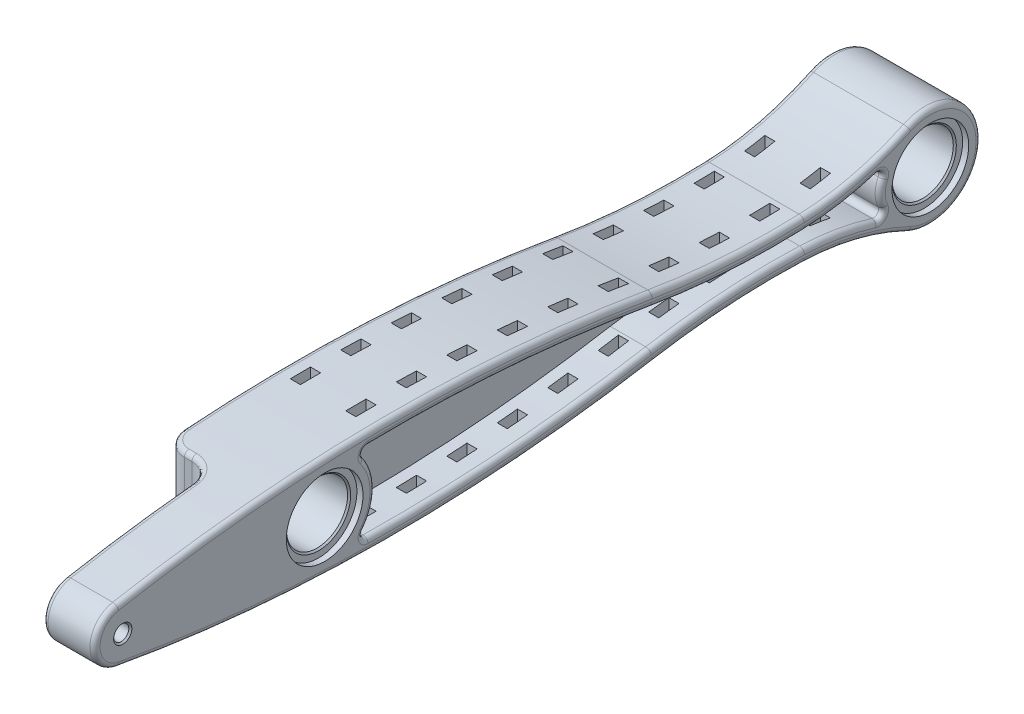
from build123d import *

# Parameters (mm, degrees)
SKETCH_1_R               = 1.5
SKETCH_1_R_2             = 6.05
EXTRUDE_1_DEPTH          = 19.8
CUT_EXTRUDE_2_DEPTH      = 132.956596089
CUT_EXTRUDE_2_DEPTH_BACK = 132.956596089
SKETCH_3_W               = 9.5
SKETCH_3_H               = 40
SKETCH_3_W_2             = 2
SKETCH_3_H_2             = 4
CUT_EXTRUDE_3_DEPTH      = 8
CUT_EXTRUDE_START        = -8
CUT_EXTRUDE_4_DEPTH      = 8
SKETCH_8_R               = 7.6
SKETCH_8_R_2             = 6.05
CUT_EXTRUDE_7_DEPTH      = 1.2
CUT_EXTRUDE_START_2      = -1.2
SKETCH_9_R               = 7.6
SKETCH_9_R_2             = 6.05
CUT_EXTRUDE_8_DEPTH      = 1.2
FILLET_4_R               = 1
FILLET_6_R               = 4
CHAMFER_1_SIZE           = 0.3
FILLET_9_R               = 1


with BuildPart() as part:
    # 草图1 → 凸台-拉伸1 (new body)
    with BuildSketch(Plane(origin=(0, 0, 0), x_dir=(0, 0, -1), z_dir=(1, 0, 0))):
        with BuildLine():
            ThreePointArc((65, 6), (11.97925586, 10.363554257), (-40.989645449, 5.410231223))
            ThreePointArc((-40.989645449, 5.410231223), (-45.5, 0), (-40.989645449, -5.410231223))
            ThreePointArc((-40.989645449, -5.410231223), (11.97925586, -10.363554257), (65, -6))
            ThreePointArc((65, -6), (79.948342089, -4.225131331), (95, -4))
            ThreePointArc((95, -4), (105.598644411, -5.47871116), (115.678175857, -9.073275928))
            ThreePointArc((115.678175857, -9.073275928), (130.05, 0), (115.678175857, 9.073275928))
            ThreePointArc((115.678175857, 9.073275928), (105.598644411, 5.47871116), (95, 4))
            ThreePointArc((95, 4), (79.948342089, 4.225131331), (65, 6))
        make_face()
        with Locations(Location((-40, 0, 0), (0, 0, 180))):
            Circle(SKETCH_1_R, mode=Mode.SUBTRACT)
        with Locations(Location((0, 0, 0), (0, 0, 180))):
            Circle(SKETCH_1_R_2, mode=Mode.SUBTRACT)
        with Locations(Location((120, 0, 0), (0, 0, 180))):
            Circle(SKETCH_1_R_2, mode=Mode.SUBTRACT)
    extrude(amount=EXTRUDE_1_DEPTH)

    # 草图3 → 切除-拉伸2 (cut, two sides: drawn at the far end of the back side and taken through both)
    with BuildSketch(Plane(origin=(0, 0, 0), x_dir=(1, 0, 0), z_dir=(0, 1, 0)).offset(-CUT_EXTRUDE_2_DEPTH_BACK)):
        with Locations((4.75, -32)):
            Rectangle(SKETCH_3_W, SKETCH_3_H)
        with Locations((4, 12)):
            Rectangle(SKETCH_3_W_2, SKETCH_3_H_2)
        with Locations((15, 12)):
            Rectangle(SKETCH_3_W_2, SKETCH_3_H_2)
        with Locations((15, 22)):
            Rectangle(SKETCH_3_W_2, SKETCH_3_H_2)
        with Locations((4, 22)):
            Rectangle(SKETCH_3_W_2, SKETCH_3_H_2)
        with Locations((4, 32)):
            Rectangle(SKETCH_3_W_2, SKETCH_3_H_2)
        with Locations((15, 32)):
            Rectangle(SKETCH_3_W_2, SKETCH_3_H_2)
        with Locations((15, 42)):
            Rectangle(SKETCH_3_W_2, SKETCH_3_H_2)
        with Locations((4, 42)):
            Rectangle(SKETCH_3_W_2, SKETCH_3_H_2)
        with Locations((4, 52)):
            Rectangle(SKETCH_3_W_2, SKETCH_3_H_2)
        with Locations((15, 52)):
            Rectangle(SKETCH_3_W_2, SKETCH_3_H_2)
        with Locations((15, 62)):
            Rectangle(SKETCH_3_W_2, SKETCH_3_H_2)
        with Locations((4, 62)):
            Rectangle(SKETCH_3_W_2, SKETCH_3_H_2)
        with Locations((4, 72)):
            Rectangle(SKETCH_3_W_2, SKETCH_3_H_2)
        with Locations((15, 72)):
            Rectangle(SKETCH_3_W_2, SKETCH_3_H_2)
        with Locations((15, 82)):
            Rectangle(SKETCH_3_W_2, SKETCH_3_H_2)
        with Locations((4, 82)):
            Rectangle(SKETCH_3_W_2, SKETCH_3_H_2)
        with Locations((4, 92)):
            Rectangle(SKETCH_3_W_2, SKETCH_3_H_2)
        with Locations((15, 92)):
            Rectangle(SKETCH_3_W_2, SKETCH_3_H_2)
        with Locations((15, 102)):
            Rectangle(SKETCH_3_W_2, SKETCH_3_H_2)
        with Locations((4, 102)):
            Rectangle(SKETCH_3_W_2, SKETCH_3_H_2)
    extrude(amount=CUT_EXTRUDE_2_DEPTH + CUT_EXTRUDE_2_DEPTH_BACK, mode=Mode.SUBTRACT)

    # 草图4 → 切除-拉伸3 (cut)
    with BuildSketch(Plane(origin=(19.8, 0, 0), x_dir=(0, 0, -1), z_dir=(1, 0, 0))):
        with BuildLine():
            ThreePointArc((64.577556068, 3.535950259), (35.534597296, 7.073768806), (6.285425983, 7.777751617))
            ThreePointArc((6.285425983, 7.777751617), (10, 0), (6.285425983, -7.777751617))
            ThreePointArc((6.285425983, -7.777751617), (35.534597296, -7.073768806), (64.577556068, -3.535950259))
            ThreePointArc((64.577556068, -3.535950259), (79.782044562, -1.730668436), (95.091619242, -1.501679381))
            ThreePointArc((95.091619242, -1.501679381), (104.604938045, -2.685632713), (113.76873849, -5.501612391))
            ThreePointArc((113.76873849, -5.501612391), (110.063143355, 0), (113.76873849, 5.501612391))
            ThreePointArc((113.76873849, 5.501612391), (104.604938045, 2.685632713), (95.091619242, 1.501679381))
            ThreePointArc((95.091619242, 1.501679381), (79.782044562, 1.730668436), (64.577556068, 3.535950259))
        make_face()
    extrude(amount=-CUT_EXTRUDE_3_DEPTH, mode=Mode.SUBTRACT)

    # 草图5 → 切除-拉伸4 (cut)
    with BuildSketch(Plane.ZY.offset(CUT_EXTRUDE_START)):
        with BuildLine():
            ThreePointArc((-6.285425983, 7.777751617), (-10, 0), (-6.285425983, -7.777751617))
            ThreePointArc((-6.285425983, -7.777751617), (-35.534597296, -7.073768806), (-64.577556068, -3.535950259))
            ThreePointArc((-64.577556068, -3.535950259), (-79.782044562, -1.730668436), (-95.091619242, -1.501679381))
            ThreePointArc((-95.091619242, -1.501679381), (-104.604938045, -2.685632713), (-113.76873849, -5.501612391))
            ThreePointArc((-113.76873849, -5.501612391), (-110.063143355, 0), (-113.76873849, 5.501612391))
            ThreePointArc((-113.76873849, 5.501612391), (-104.604938045, 2.685632713), (-95.091619242, 1.501679381))
            ThreePointArc((-95.091619242, 1.501679381), (-79.782044562, 1.730668436), (-64.577556068, 3.535950259))
            ThreePointArc((-64.577556068, 3.535950259), (-35.534597296, 7.073768806), (-6.285425983, 7.777751617))
        make_face()
    extrude(amount=CUT_EXTRUDE_4_DEPTH, mode=Mode.SUBTRACT)

    # 草图8 → 切除-拉伸7 (cut)
    # profile 1 of 3: a face of its own
    with BuildSketch(Plane.ZY):
        Circle(SKETCH_8_R)
        Circle(SKETCH_8_R_2, mode=Mode.SUBTRACT)
    # profile 2 of 3: a face of its own
    with BuildSketch(Plane.ZY):
        Circle(SKETCH_8_R_2)
    # profile 3 of 3: a face of its own
    with BuildSketch(Plane.ZY):
        with Locations((-120, 0)):
            Circle(SKETCH_8_R)
    extrude(amount=-CUT_EXTRUDE_7_DEPTH, mode=Mode.SUBTRACT)

    # 草图9 → 切除-拉伸8 (cut)
    # profile 1 of 3: a face of its own
    with BuildSketch(Plane(origin=(19.8, 0, 0), x_dir=(0, 0, -1), z_dir=(1, 0, 0)).offset(CUT_EXTRUDE_START_2)):
        with Locations(Location((0, 0, 0), (0, 0, 180))):
            Circle(SKETCH_9_R)
        with Locations(Location((0, 0, 0), (0, 0, 180))):
            Circle(SKETCH_9_R_2, mode=Mode.SUBTRACT)
    # profile 2 of 3: a face of its own
    with BuildSketch(Plane(origin=(19.8, 0, 0), x_dir=(0, 0, -1), z_dir=(1, 0, 0)).offset(CUT_EXTRUDE_START_2)):
        with Locations(Location((0, 0, 0), (0, 0, 180))):
            Circle(SKETCH_9_R_2)
    # profile 3 of 3: a face of its own
    with BuildSketch(Plane(origin=(19.8, 0, 0), x_dir=(0, 0, -1), z_dir=(1, 0, 0)).offset(CUT_EXTRUDE_START_2)):
        with Locations(Location((120, 0, 0), (0, 0, 180))):
            Circle(SKETCH_9_R)
    extrude(amount=CUT_EXTRUDE_8_DEPTH, mode=Mode.SUBTRACT)

    # 圆角4
    fillet_4_edges = [part.edges().sort_by_distance(p)[0] for p in [
        (15.8, 7.777751617, -6.285425983),
        (15.8, 5.501612391, -113.76873849),
        (15.8, -5.501612391, -113.76873849),
        (15.8, -7.777751617, -6.285425983),
        (4, -7.777751617, -6.285425983),
        (4, 7.777751617, -6.285425983),
        (4, -5.501612391, -113.76873849),
        (4, 5.501612391, -113.76873849),
    ]]
    fillet(fillet_4_edges, radius=FILLET_4_R)

    # 圆角6
    fillet_6_edges = [part.edges().sort_by_distance(p)[0] for p in [
        (9.5, 0, 12),
        (0, 0, 12),
    ]]
    fillet(fillet_6_edges, radius=FILLET_6_R)

    # 倒角1
    chamfer_1_edges = [part.edges().sort_by_distance(p)[0] for p in [
        (9.5, 0, 38.5),
        (19.8, 0, 38.5),
        (1.2, 0, -6.05),
        (1.2, 0, -126.05),
        (18.6, 0, -6.05),
        (18.6, 0, -126.05),
    ]]
    chamfer(chamfer_1_edges, length=CHAMFER_1_SIZE)

    # 圆角9
    fillet_9_edges = [part.edges().sort_by_distance(p)[0] for p in [
        (9.5, 0, 45.5),
        (0, -5.47871116, -105.598644411),
        (0, -4.225131331, -79.948342089),
        (0, 4.225131331, -79.948342089),
        (0, 5.47871116, -105.598644411),
        (0, 0, -130.05),
        (19.8, 0, -130.05),
        (19.8, 5.47871116, -105.598644411),
        (19.8, 4.225131331, -79.948342089),
        (19.8, 10.363554257, -11.97925586),
        (19.8, 0, 45.5),
        (19.8, -10.363554257, -11.97925586),
        (19.8, -4.225131331, -79.948342089),
        (19.8, -5.47871116, -105.598644411),
        (19.8, -1.730668436, -79.782044562),
        (19.8, 1.730668436, -79.782044562),
        (19.8, 2.251944415, -102.351567627),
        (19.8, 6.987191562, -36.69348525),
        (0, -1.730668436, -79.782044562),
        (0, -2.251944415, -102.351567627),
        (0, 1.730668436, -79.782044562),
        (0, -6.987191562, -36.69348525),
        (19.8, 0, -110.063143355),
        (19.8, -2.251944415, -102.351567627),
        (19.8, -6.987191562, -36.69348525),
        (19.8, 0, -10),
        (0, 0, -10),
        (0, 6.987191562, -36.69348525),
        (0, 0, -110.063143355),
        (0, 2.251944415, -102.351567627),
        (19.8, -3.654876348, -110.502510255),
        (19.8, 3.654876344, -110.50251026),
        (19.8, -7.253903034, -7.722182045),
        (19.8, 7.253903034, -7.722182045),
        (0, -7.253903034, -7.722182045),
        (0, 7.253903034, -7.722182045),
        (0, -3.654876358, -110.50251028),
        (0, 3.65487635, -110.502510255),
        (4.75, -9.28173835, 12),
        (4.75, 9.28173835, 12),
        (9.5, -7.422645768, 28.531240162),
        (9.5, 7.422645768, 28.531240162),
        (0, -10.000697418, -28.608496434),
        (1.169640137, -9.378968635, 10.826493097),
        (0, 10.000697418, -28.608496434),
        (1.169640137, 9.378968635, 10.826493097),
        (8.33163613, 9.179812207, 13.174785536),
        (8.33163613, -9.179812207, 13.174785536),
    ]]
    fillet(fillet_9_edges, radius=FILLET_9_R)


solid = part.part
